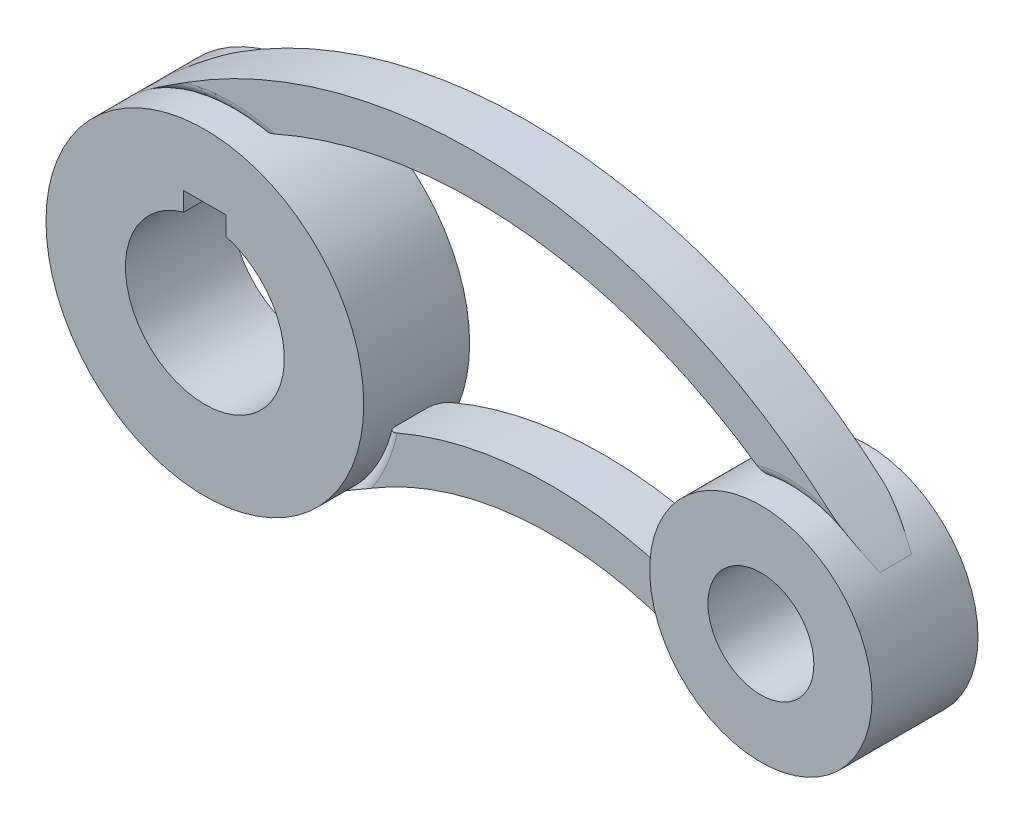
from build123d import *

# Parameters (mm, degrees)
IZIM1_R                       = 300
Y_KSEKLIK_EKSTR_ZYON1_DEPTH   = 100
IZIM1_R_2                     = 210
IZIM1_R_3                     = 100
Y_KSEKLIK_EKSTR_ZYON1_2_DEPTH = 100
Y_KSEKLIK_EKSTR_ZYON2_DEPTH   = 50
Y_KSEKLIK_EKSTR_ZYON2_2_DEPTH = 50
RADYUS1_R                     = 20
RADYUS2_R                     = 20


with BuildPart() as part:
    # Çizim1 → Yükseklik-Ekstrüzyon1 (new, symmetric)
    with BuildSketch(Plane.XY):
        with Locations((-441.537357111, 4.676255954)):
            Circle(IZIM1_R)
        with BuildLine():
            Line((-481.537357111, 149.244578902), (-481.537357111, 184.676255954))
            Line((-481.537357111, 184.676255954), (-401.537357111, 184.676255954))
            Line((-401.537357111, 184.676255954), (-401.537357111, 149.244578902))
            ThreePointArc((-401.537357111, 149.244578902), (-441.537357111, -145.323744046), (-481.537357111, 149.244578902))
        make_face(mode=Mode.SUBTRACT)
    extrude(amount=Y_KSEKLIK_EKSTR_ZYON1_DEPTH, both=True)


with BuildPart() as body_2:
    # Çizim1 → Y_kseklik-Ekstr_zyon1 2 (new, symmetric)
    with BuildSketch(Plane.XY):
        with Locations((608.462642889, 4.676255954)):
            Circle(IZIM1_R_2)
        with Locations((608.462642889, 4.676255954)):
            Circle(IZIM1_R_3, mode=Mode.SUBTRACT)
    extrude(amount=Y_KSEKLIK_EKSTR_ZYON1_2_DEPTH, both=True)


with BuildPart() as body_3:
    # Çizim1<3> → Yükseklik-Ekstrüzyon2 (new, symmetric)
    with BuildSketch(Plane.XY):
        with BuildLine():
            ThreePointArc((-635.382602288, 233.639180731), (-519.172061184, 294.456953592), (-388.121481329, 299.882529963))
            ThreePointArc((-388.121481329, 299.882529963), (104.103777024, 389.355835491), (571.686866818, 211.431043793))
            ThreePointArc((571.686866818, 211.431043793), (675.548463161, 203.672468778), (762.908732593, 146.966119876))
            ThreePointArc((762.908732593, 146.966119876), (81.183779413, 471.349997153), (-635.382602288, 233.639180731))
        make_face()
    extrude(amount=Y_KSEKLIK_EKSTR_ZYON2_DEPTH, both=True)

    # Radyus1
    radyus1_edges = [body_3.edges().sort_by_distance(p)[0] for p in [
        (675.548463161, 203.672468778, -50),
        (675.548463161, 203.672468778, 50),
        (-519.172061184, 294.456953592, -50),
        (-519.172061184, 294.456953592, 50),
    ]]
    fillet(radyus1_edges, radius=RADYUS1_R)


with BuildPart() as body_4:
    # Çizim1<3> → Y_kseklik-Ekstr_zyon2 2 (new, symmetric)
    with BuildSketch(Plane.XY):
        with BuildLine():
            ThreePointArc((403.664287394, -41.774078669), (123.462554094, -1.596728042), (-151.099867808, -70.464044867))
            ThreePointArc((-151.099867808, -70.464044867), (-188.944531424, -157.178198453), (-251.912534947, -227.794014875))
            ThreePointArc((-251.912534947, -227.794014875), (115.560113638, -82.223624751), (499.771111256, -175.007218387))
            ThreePointArc((499.771111256, -175.007218387), (438.148977222, -118.178354409), (403.664287394, -41.774078669))
        make_face()
    extrude(amount=Y_KSEKLIK_EKSTR_ZYON2_2_DEPTH, both=True)

    # Radyus2
    radyus2_edges = [body_4.edges().sort_by_distance(p)[0] for p in [
        (438.148977222, -118.178354409, 50),
        (438.148977222, -118.178354409, -50),
        (-188.944531424, -157.178198453, -50),
        (-188.944531424, -157.178198453, 50),
    ]]
    fillet(radyus2_edges, radius=RADYUS2_R)


solid = Compound([part.part, body_2.part, body_3.part, body_4.part])
